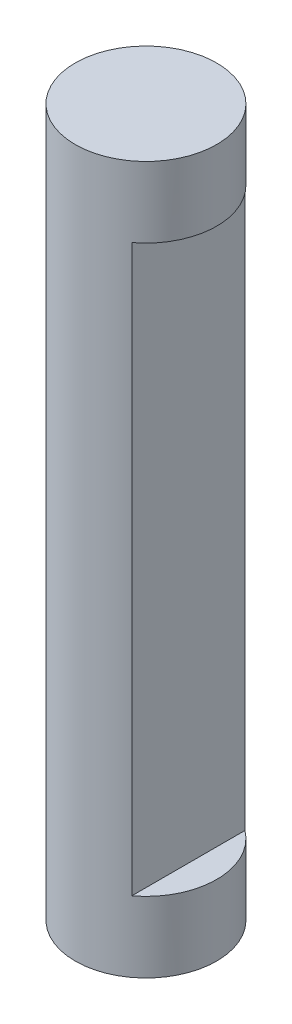
from build123d import *

# Parameters (mm, degrees)
SKETCH1_R           = 50
BOSS_EXTRUDE1_DEPTH = 500
SKETCH2_R           = 25
CUT_EXTRUDE1_DEPTH  = 20
SKETCH3_W           = 200
SKETCH3_H           = 400
CUT_EXTRUDE2_DEPTH  = 50


with BuildPart() as part:
    # Sketch1 → Boss-Extrude1 (new body)
    with BuildSketch(Plane(origin=(0, 0, 0), x_dir=(1, 0, 0), z_dir=(0, 1, 0))):
        with Locations(Location((0, 0, 0), (0, 0, 270))):
            Circle(SKETCH1_R)
    extrude(amount=BOSS_EXTRUDE1_DEPTH)

    # Sketch2 → Cut-Extrude1 (cut)
    with BuildSketch(Plane.XZ):
        with Locations(Location((0, 0, 0), (0, 0, 270))):
            Circle(SKETCH2_R)
    extrude(amount=-CUT_EXTRUDE1_DEPTH, mode=Mode.SUBTRACT)

    # Sketch3 → Cut-Extrude2 (cut)
    with BuildSketch(Plane(origin=(30, 0, 0), x_dir=(0, 0, -1), z_dir=(1, 0, 0))):
        with Locations((0, 250)):
            Rectangle(SKETCH3_W, SKETCH3_H)
    extrude(amount=CUT_EXTRUDE2_DEPTH, mode=Mode.SUBTRACT)


solid = part.part
